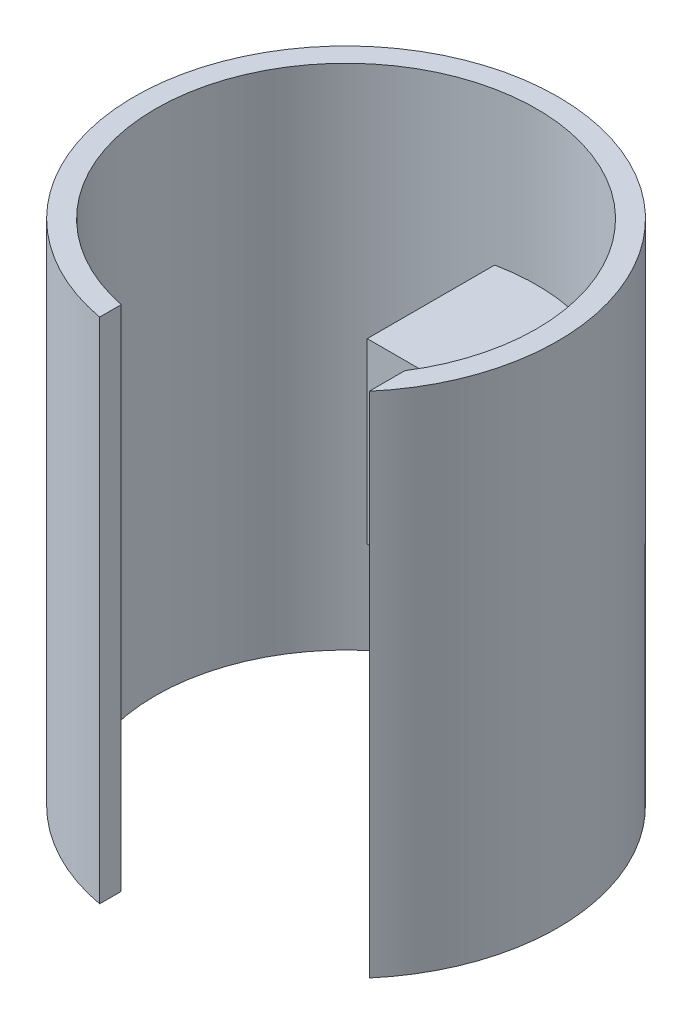
from build123d import *

# Parameters (mm, degrees)
CROQUIS1_R                   = 50
SALIENTE_EXTRUIR1_DEPTH      = 120
CORTAR_EXTRUIR1_REACH        = 141.284
CROQUIS2_R                   = 45
SALIENTE_EXTRUIR2_REACH      = 141.284
SALIENTE_EXTRUIR2_END_RADIUS = 45
CROQUIS4_W                   = 47
CROQUIS4_H                   = 42
CROQUIS5_W                   = 47
CROQUIS5_H                   = 42
CORTAR_EXTRUIR2_DEPTH        = 14
CORTAR_EXTRUIR3_REACH        = 141.284


with BuildPart() as part:
    # Croquis1 → Saliente-Extruir1 (new body)
    with BuildSketch(Plane(origin=(0, 0, 0), x_dir=(1, 0, 0), z_dir=(0, 1, 0))):
        with Locations(Location((0, 0, 0), (0, 0, 270))):
            Circle(CROQUIS1_R)
    extrude(amount=SALIENTE_EXTRUIR1_DEPTH)

    # Croquis2 → Cortar-Extruir1 (cut, up to next)
    with BuildSketch(Plane(origin=(0, 120, 0), x_dir=(1, 0, 0), z_dir=(0, 1, 0)), mode=Mode.PRIVATE) as cortar_extruir1_sk1:
        with Locations(Location((0, 0, 0), (0, 0, 270))):
            Circle(CROQUIS2_R)
    cortar_extruir1_tool1 = extrude(cortar_extruir1_sk1.sketch, amount=-CORTAR_EXTRUIR1_REACH, mode=Mode.PRIVATE) & part.part
    add(cortar_extruir1_tool1.solids().sort_by_distance((0, 120, 0))[0], mode=Mode.SUBTRACT)

    # Saliente-Extruir2: up to this cylinder (the profile starts inside it)
    saliente_extruir2_end = Plane(origin=(0, 63, 0), z_dir=(0, 1, 0)) * Cylinder(SALIENTE_EXTRUIR2_END_RADIUS, 373.568, mode=Mode.PRIVATE)
    # Croquis4 → Saliente-Extruir2 (add, up to the surface)
    with BuildSketch(Plane.XY, mode=Mode.PRIVATE) as saliente_extruir2_sk1:
        with Locations((14.5, 63)):
            Rectangle(CROQUIS4_W, CROQUIS4_H)
    saliente_extruir2_tool1 = extrude(saliente_extruir2_sk1.sketch, amount=-SALIENTE_EXTRUIR2_REACH, mode=Mode.PRIVATE) & saliente_extruir2_end
    add(saliente_extruir2_tool1.solids().sort_by_distance((14.5, 63, 0))[0])

    # Croquis5 → Cortar-Extruir2 (cut)
    with BuildSketch(Plane.XY):
        with Locations((14.5, 63)):
            Rectangle(CROQUIS5_W, CROQUIS5_H)
    extrude(amount=-CORTAR_EXTRUIR2_DEPTH, mode=Mode.SUBTRACT)

    # Croquis7 → Cortar-Extruir3 (cut, up to next)
    with BuildSketch(Plane(origin=(0, 120, 0), x_dir=(1, 0, 0), z_dir=(0, 1, 0)), mode=Mode.PRIVATE) as cortar_extruir3_sk1:
        with BuildLine():
            Line((-9, -44.09081537), (-9, -49.183330509))
            ThreePointArc((-9, -49.183330509), (16.72918014, -47.118303576), (38, -32.496153619))
            Line((38, -32.496153619), (38, -24.103941586))
            ThreePointArc((38, -24.103941586), (17.61018969, -41.41112434), (-9, -44.09081537))
        make_face()
    cortar_extruir3_tool1 = extrude(cortar_extruir3_sk1.sketch, amount=-CORTAR_EXTRUIR3_REACH, mode=Mode.PRIVATE) & part.part
    add(cortar_extruir3_tool1.solids().sort_by_distance((16.242492, 120, 42.000337))[0], mode=Mode.SUBTRACT)


solid = part.part
